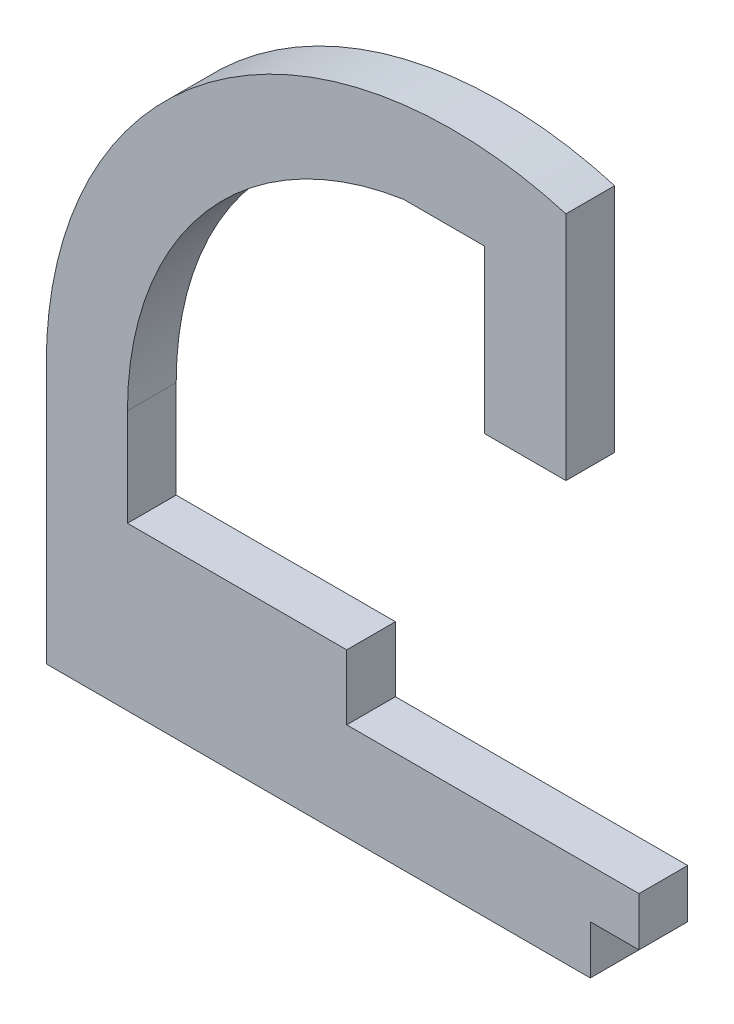
from build123d import *

# Parameters (mm, degrees)
EXTRUDE_1_DEPTH = 6


with BuildPart() as part:
    # Эскиз2 → Бобышка-Вытянуть1 (new body)
    with BuildSketch(Plane.XY):
        with BuildLine():
            Line((10, 20), (10, 32))
            ThreePointArc((10, 32), (19.668498224, 58.076809621), (44, 71.547439867))
            Line((44, 71.547439867), (54, 71.547439867))
            Line((54, 71.547439867), (54, 51.547439867))
            Line((54, 51.547439867), (64, 51.547439867))
            Line((64, 51.547439867), (64, 80))
            ThreePointArc((64, 80), (20, 72), (0, 32))
            Line((0, 32), (0, 0))
            Line((0, 0), (67, 0))
            Line((67, 0), (67, 6))
            Line((67, 6), (73, 6))
            Line((73, 6), (73, 12))
            Line((73, 12), (67, 12))
            Line((67, 12), (37, 12))
            Line((37, 12), (37, 20))
            Line((37, 20), (10, 20))
        make_face()
    extrude(amount=EXTRUDE_1_DEPTH)


solid = part.part
